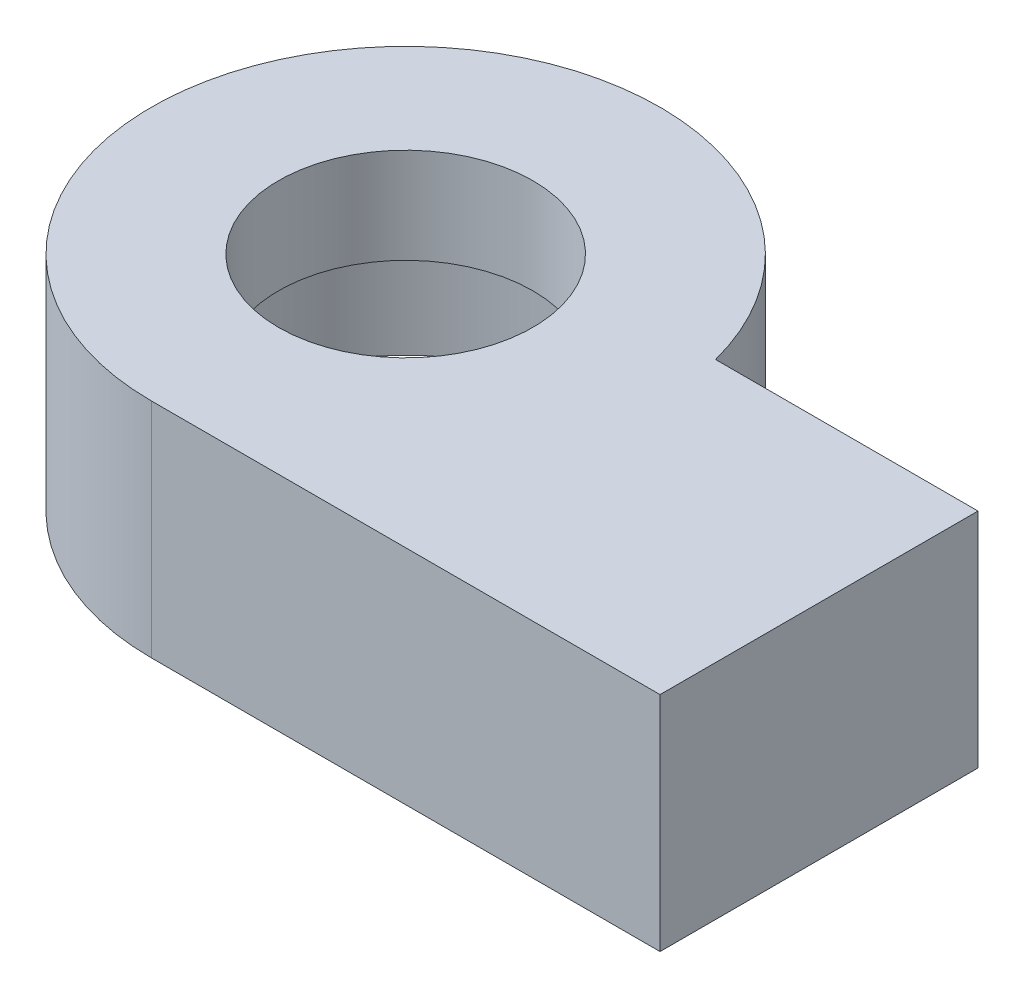
from build123d import *

# Parameters (mm, degrees)
BOSS_EXTRUDE1_DEPTH = 3.5
SKETCH2_R           = 3
CUT_EXTRUDE1_DEPTH  = 2
SKETCH3_R           = 2
CUT_EXTRUDE2_DEPTH  = 10.16515139


with BuildPart() as part:
    # Sketch1 → Boss-Extrude1 (new body)
    with BuildSketch(Plane(origin=(0, 0, 0), x_dir=(1, 0, 0), z_dir=(0, 1, 0))):
        with BuildLine():
            Line((0, -4), (8, -4))
            Line((8, -4), (8, 1))
            Line((8, 1), (3.872983346, 1))
            ThreePointArc((3.872983346, 1), (-3.16227766, 2.449489743), (0, -4))
        make_face()
    extrude(amount=BOSS_EXTRUDE1_DEPTH)

    # Sketch2 → Cut-Extrude1 (cut)
    with BuildSketch(Plane.XZ):
        with Locations(Location((0, 0, 0), (0, 0, 270))):
            Circle(SKETCH2_R)
    extrude(amount=-CUT_EXTRUDE1_DEPTH, mode=Mode.SUBTRACT)

    # Sketch3 → Cut-Extrude2 (cut, through all)
    with BuildSketch(Plane.XZ.offset(-2)):
        with Locations(Location((0, 0, 0), (0, 0, 270))):
            Circle(SKETCH3_R)
    extrude(amount=-CUT_EXTRUDE2_DEPTH, mode=Mode.SUBTRACT)


solid = part.part
